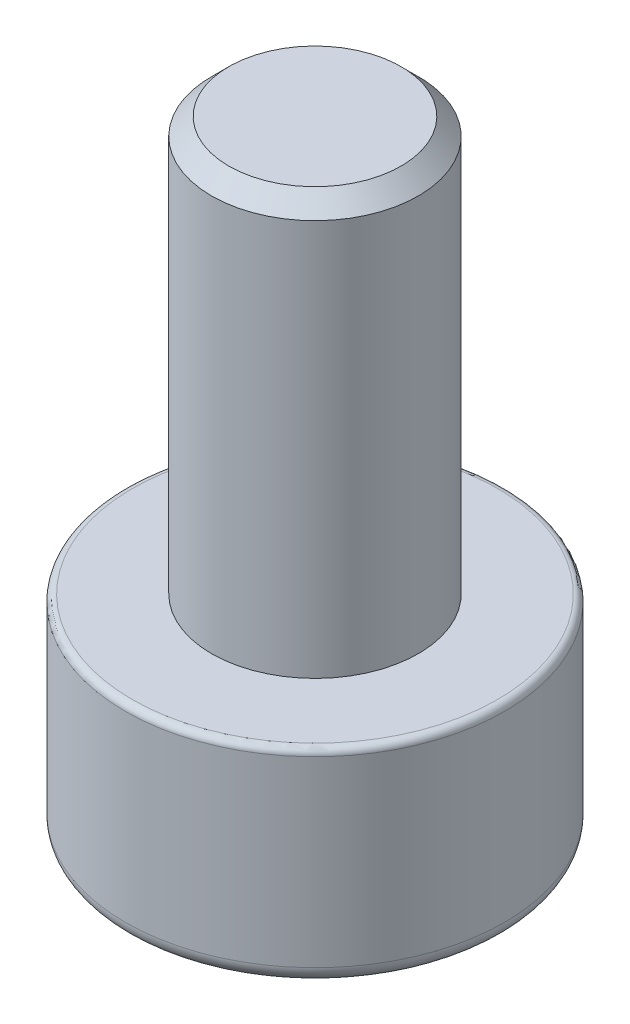
from build123d import *

# Parameters (mm, degrees)
SKETCH1_R           = 2.75
BOSS_EXTRUDE1_DEPTH = 3
SKETCH2_R           = 1.5
BOSS_EXTRUDE2_DEPTH = 6
CUT_EXTRUDE1_DEPTH  = 1.5
CHAMFER1_SIZE       = 0.25
FILLET1_R           = 0.25
CHAMFER2_SIZE       = 0.25
FILLET2_R           = 0.1


with BuildPart() as part:
    # Sketch1 → Boss-Extrude1 (new body)
    with BuildSketch(Plane(origin=(0, 0, 0), x_dir=(1, 0, 0), z_dir=(0, 1, 0))):
        with Locations(Location((0, 0, 0), (0, 0, 270))):
            Circle(SKETCH1_R)
    extrude(amount=BOSS_EXTRUDE1_DEPTH)

    # Sketch2 → Boss-Extrude2 (add)
    with BuildSketch(Plane(origin=(0, 3, 0), x_dir=(1, 0, 0), z_dir=(0, 1, 0))):
        with Locations(Location((0, 0, 0), (0, 0, 270))):
            Circle(SKETCH2_R)
    extrude(amount=BOSS_EXTRUDE2_DEPTH)

    # Sketch3 → Cut-Extrude1 (cut)
    with BuildSketch(Plane.XZ):
        Polygon((0.934168857, 0.974591477), (-0.376936549, 1.2963097), (-1.311105406, 0.321718223), (-0.934168857, -0.974591477), (0.376936549, -1.2963097), (1.311105406, -0.321718223), align=None)
    extrude(amount=-CUT_EXTRUDE1_DEPTH, mode=Mode.SUBTRACT)

    # Chamfer1
    chamfer1_edges = [part.edges().sort_by_distance(p)[0] for p in [
        (1.122637131, 0, 0.326436627),
        (0.278616154, 0, 1.135450588),
        (-0.844020977, 0, 0.809013962),
        (-1.122637131, 0, -0.326436627),
        (-0.278616154, 0, -1.135450588),
        (0.844020977, 0, -0.809013962),
    ]]
    chamfer(chamfer1_edges, length=CHAMFER1_SIZE)

    # Fillet1
    fillet1_edges = [part.edges().sort_by_distance(p)[0] for p in [
        (0, 0, -2.75),
    ]]
    fillet(fillet1_edges, radius=FILLET1_R)

    # Chamfer2
    chamfer2_edges = [part.edges().sort_by_distance(p)[0] for p in [
        (0, 9, -1.5),
    ]]
    chamfer(chamfer2_edges, length=CHAMFER2_SIZE)

    # Fillet2
    fillet2_edges = [part.edges().sort_by_distance(p)[0] for p in [
        (0, 3, -2.75),
    ]]
    fillet(fillet2_edges, radius=FILLET2_R)


solid = part.part
